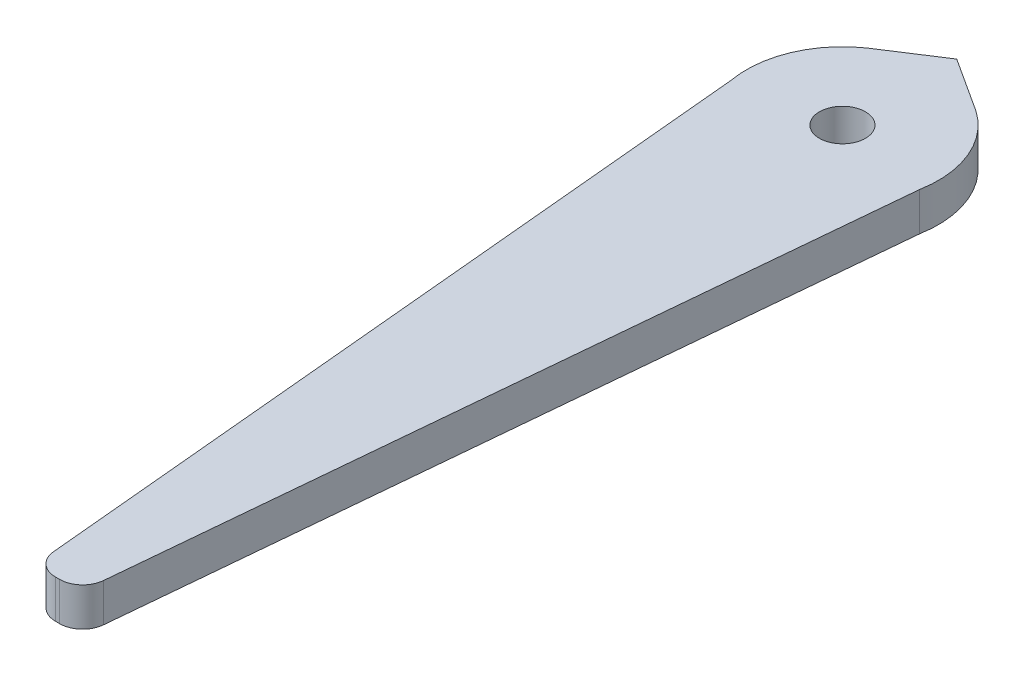
from build123d import *

# Parameters (mm, degrees)
CROQUIS1_R              = 3
SALIENTE_EXTRUIR1_DEPTH = 5
REDONDEO1_R             = 2.99


with BuildPart() as part:
    # Croquis1 → Saliente-Extruir1 (new body)
    with BuildSketch(Plane(origin=(0, 0, 0), x_dir=(1, 0, 0), z_dir=(0, 1, 0))):
        with BuildLine():
            Line((-7.962657019, 208.875039065), (-0.868497325, 213.470388318))
            Line((-0.868497325, 213.470388318), (6.225662369, 208.875039065))
            ThreePointArc((6.225662369, 208.875039065), (10.67506724, 203.378580688), (11.42992133, 196.347332315))
            Line((11.42992133, 196.347332315), (2.131502675, 96.347332315))
            Line((2.131502675, 96.347332315), (-3.868497325, 96.347332315))
            Line((-3.868497325, 96.347332315), (-13.166915979, 196.347332315))
            ThreePointArc((-13.166915979, 196.347332315), (-12.412061889, 203.378580688), (-7.962657019, 208.875039065))
        make_face()
        with Locations(Location((-0.868497325, 198.583153998, 0), (0, 0, 270))):
            Circle(CROQUIS1_R, mode=Mode.SUBTRACT)
    extrude(amount=SALIENTE_EXTRUIR1_DEPTH)

    # Redondeo1
    redondeo1_edges = [part.edges().sort_by_distance(p)[0] for p in [
        (2.131502675, 2.5, -96.347332315),
        (-3.868497325, 2.5, -96.347332315),
    ]]
    fillet(redondeo1_edges, radius=REDONDEO1_R)


solid = part.part
